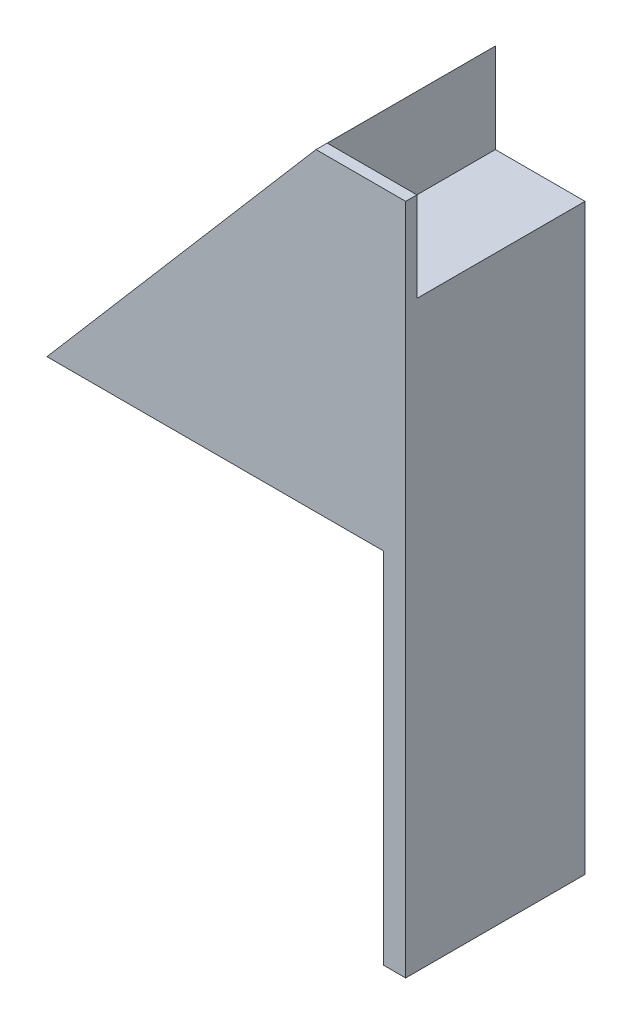
from build123d import *

# Parameters (mm, degrees)
BOSS_EXTRUDE1_DEPTH = 12.7
SKETCH2_W           = 12.7
SKETCH2_H           = 12.7
CUT_EXTRUDE1_DEPTH  = 23.8125


with BuildPart() as part:
    # Sketch1 → Boss-Extrude1 (new, symmetric)
    with BuildSketch(Plane.XY):
        Polygon((19.05, -50.8), (19.05, 0), (-28.575, 0), (9.525, 44.45), (22.225, 44.45), (22.225, 31.75), (22.225, -50.8), align=None)
    extrude(amount=BOSS_EXTRUDE1_DEPTH, both=True)

    # Sketch2 → Cut-Extrude1 (cut)
    with BuildSketch(Plane(origin=(0, 0, -12.7), x_dir=(-1, 0, 0), z_dir=(0, 0, -1))):
        with Locations((-15.875, 38.1)):
            Rectangle(SKETCH2_W, SKETCH2_H)
    extrude(amount=-CUT_EXTRUDE1_DEPTH, mode=Mode.SUBTRACT)


solid = part.part
